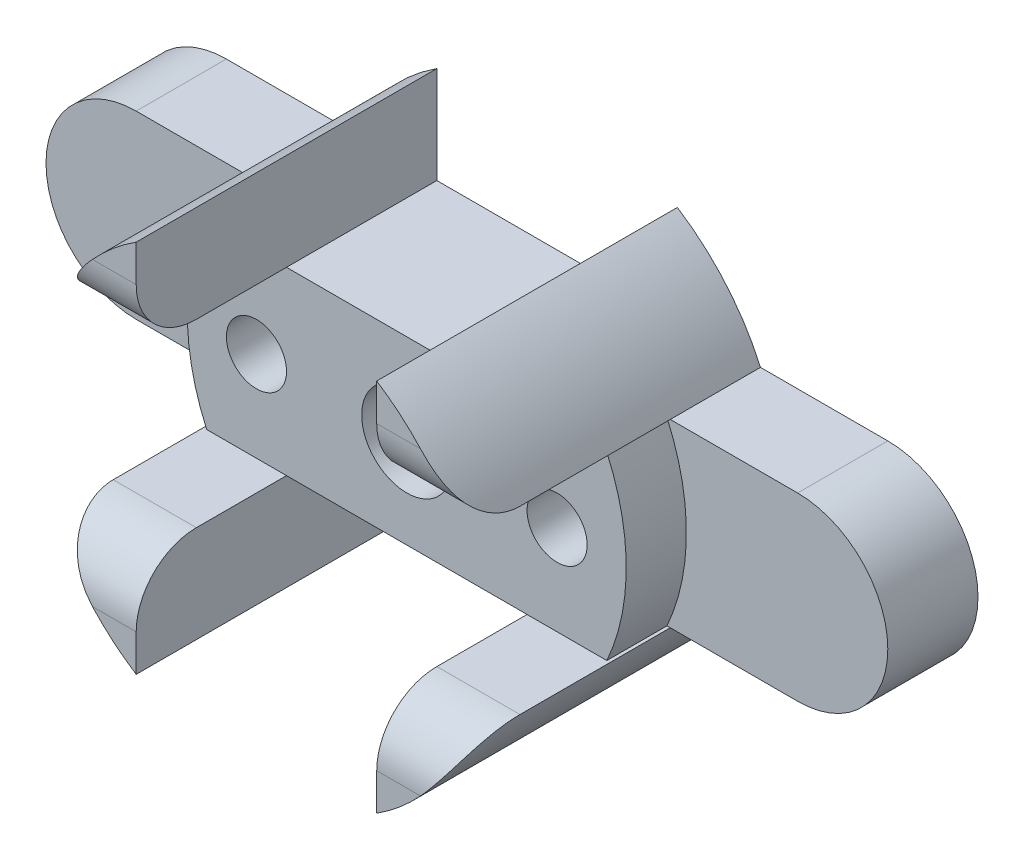
from build123d import *

# Parameters (mm, degrees)
SKETCH_2_W          = 49.662427868
SKETCH_2_H          = 43.948008528
CUT_EXTRUDE_1_DEPTH = 10
SKETCH_3_R          = 1.5
SKETCH_3_R_2        = 1
CUT_EXTRUDE_2_DEPTH = 16.165750888
EXTRUDE_1_DEPTH     = 10
FILLET_1_R          = 2


with BuildPart() as part:
    # 草图1 → 旋转3 (revolve)
    with BuildSketch(Plane(origin=(0, 0, 0), x_dir=(1, 0, 0), z_dir=(0, 1, 0)), mode=Mode.PRIVATE) as revolve_3_sk:
        Polygon((0, 0), (0, 5), (20, 5), (20, 2), (7.3, 2), (7.3, 0), align=None)
    revolve(revolve_3_sk.sketch.rotate(Axis((0, 0, 0), (0, 0, 1)), 180), axis=Axis((0, 0, 0), (0, 0, 1)))

    # 草图2 → 切除-拉伸1 (cut)
    with BuildSketch(Plane.XY):
        Rectangle(SKETCH_2_W, SKETCH_2_H)
        with BuildLine():
            Line((11, -3), (-11, -3))
            ThreePointArc((-11, -3), (-14, 0), (-11, 3))
            Line((-11, 3), (11, 3))
            ThreePointArc((11, 3), (14, 0), (11, -3))
        make_face(mode=Mode.SUBTRACT)
    extrude(amount=-CUT_EXTRUDE_1_DEPTH, mode=Mode.SUBTRACT)

    # 草图3 → 切除-拉伸2 (cut, through all)
    with BuildSketch(Plane.XY):
        Circle(SKETCH_3_R)
        with Locations((5, 0)):
            Circle(SKETCH_3_R_2)
        with Locations((-5, 0)):
            Circle(SKETCH_3_R_2)
    extrude(amount=-CUT_EXTRUDE_2_DEPTH, mode=Mode.SUBTRACT)

    # 草图4 → 凸台-拉伸1 (add)
    with BuildSketch(Plane(origin=(0, 0, -5), x_dir=(-1, 0, 0), z_dir=(0, 0, -1))):
        with BuildLine():
            Line((-4, 3), (-4, 6.225752967))
            ThreePointArc((-4, 6.225752967), (-5.618771945, 4.815537543), (-6.76461381, 3))
            Line((-6.76461381, 3), (-4, 3))
        make_face()
        with BuildLine():
            ThreePointArc((6.76461381, 3), (5.618771945, 4.815537543), (4, 6.225752967))
            Line((4, 6.225752967), (4, 3))
            Line((4, 3), (6.76461381, 3))
        make_face()
        with BuildLine():
            Line((6.76461381, -3), (4, -3))
            Line((4, -3), (4, -6.225752967))
            ThreePointArc((4, -6.225752967), (5.618771945, -4.815537543), (6.76461381, -3))
        make_face()
        with BuildLine():
            Line((-4, -6.225752967), (-4, -3))
            Line((-4, -3), (-6.76461381, -3))
            ThreePointArc((-6.76461381, -3), (-5.618771945, -4.815537543), (-4, -6.225752967))
        make_face()
    extrude(amount=-EXTRUDE_1_DEPTH)

    # 圆角1
    fillet_1_edges = [part.edges().sort_by_distance(p)[0] for p in [
        (5.382306905, -3, 5),
        (5.382306905, 3, 5),
        (-5.382306905, 3, 5),
        (-5.382306905, -3, 5),
    ]]
    fillet(fillet_1_edges, radius=FILLET_1_R)


solid = part.part
